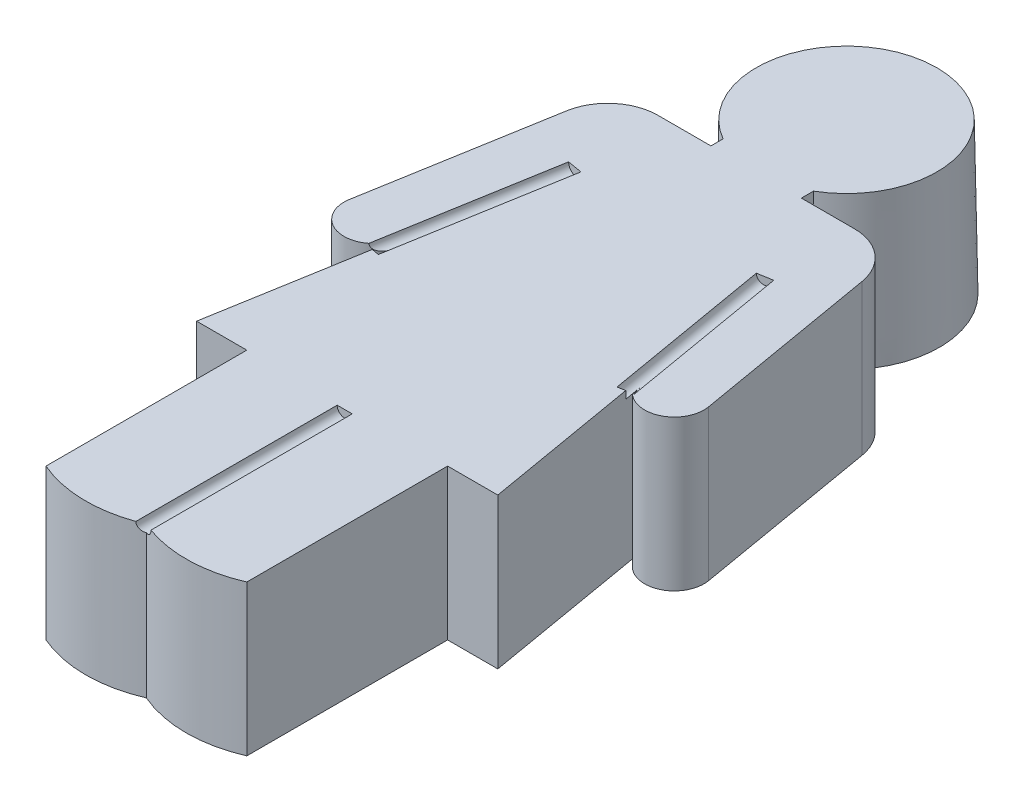
from build123d import *

# Parameters (mm, degrees)
CROQUIS1_R               = 9
SALIENTE_EXTRUIR1_DEPTH  = 15
CORTAR_BARRER3_PROFILE_R = 0.75
CROQUIS150_W             = 9.005753034
CROQUIS150_H             = 1.22445073
SALIENTE_EXTRUIR2_DEPTH  = 15
NGULO_DE_SALIDA1_ANGLE   = 1
REDONDEO1_R              = 5
CORTAR_BARRER6_PROFILE_R = 0.75
CORTAR_BARRER7_PROFILE_R = 0.75


with BuildPart() as part:
    # Croquis1 → Saliente-Extruir1 (new body)
    with BuildSketch(Plane(origin=(0, 0, 0), x_dir=(1, 0, 0), z_dir=(0, 1, 0))):
        with BuildLine():
            Line((-10, -15.730529609), (-10, -35.730529609))
            ThreePointArc((-10, -35.730529609), (-5, -36.769633088), (0, -35.730529609))
            ThreePointArc((0, -35.730529609), (5, -36.769633088), (10, -35.730529609))
            Line((10, -35.730529609), (10, -15.730529609))
            Line((10, -15.730529609), (15, -15.730529609))
            Line((15, -15.730529609), (12.060158198, 1.375372328))
            ThreePointArc((12.060158198, 1.375372328), (15.474883642, -1.037768667), (17.888024636, 2.376956777))
            Line((17.888024636, 2.376956777), (14, 25))
            Line((14, 25), (9, 25))
            Line((9, 25), (3.3e-08, 25))
            Line((3.3e-08, 25), (-9, 25))
            Line((-9, 25), (-14, 25))
            Line((-14, 25), (-17.888024636, 2.376956777))
            ThreePointArc((-17.888024636, 2.376956777), (-15.474883642, -1.037768667), (-12.060158198, 1.375372328))
            Line((-12.060158198, 1.375372328), (-15, -15.730529609))
            Line((-15, -15.730529609), (-10, -15.730529609))
        make_face()
        with Locations(Location((0, 34, 0), (0, 0, 270))):
            Circle(CROQUIS1_R)
    extrude(amount=SALIENTE_EXTRUIR1_DEPTH)

    # Cortar-Barrer3: sweep along a path in Croquis128
    with BuildLine(Plane(origin=(0, 15, 0), x_dir=(1, 0, 0), z_dir=(0, 1, 0))) as cortar_barrer3_path:
        Line((0, -37.988500145), (0, -15.977369951))
    # Cortar-Barrer3 profile (on start of the path) → Cortar-Barrer3 (sweep, cut)
    with BuildSketch(Plane(origin=(0, 15, 37.988500145), x_dir=(-1, 0, 0), z_dir=(0, 0, -1))):
        Circle(CORTAR_BARRER3_PROFILE_R)
    sweep(path=cortar_barrer3_path.line, mode=Mode.SUBTRACT)

    # Croquis150 → Saliente-Extruir2 (add)
    with BuildSketch(Plane(origin=(0, 15, 0), x_dir=(1, 0, 0), z_dir=(0, 1, 0))):
        with Locations((0, 25.595207467)):
            Rectangle(CROQUIS150_W, CROQUIS150_H)
    extrude(amount=-SALIENTE_EXTRUIR2_DEPTH)

    # Ángulo de salida1
    ngulo_de_salida1_faces = [part.faces().sort_by_distance(p)[0] for p in [
        (0, 7.5, -43),
    ]]
    draft(ngulo_de_salida1_faces, Plane.ZX.offset(15), NGULO_DE_SALIDA1_ANGLE)

    # Redondeo1
    redondeo1_edges = [part.edges().sort_by_distance(p)[0] for p in [
        (14, 7.5, -25),
        (-14, 7.5, -25),
    ]]
    fillet(redondeo1_edges, radius=REDONDEO1_R)

    # Cortar-Barrer6: sweep along a path in Croquis153
    with BuildLine(Plane(origin=(0, 15, 0), x_dir=(1, 0, 0), z_dir=(0, 1, 0))) as cortar_barrer6_path:
        Line((-12.434351293, -0.801925236), (-9.476182309, 16.410616107))
    # Cortar-Barrer6 profile (on start of the path) → Cortar-Barrer6 (sweep, cut)
    with BuildSketch(Plane(origin=(-12.434351293, 15, 0.801925236), x_dir=(-0.9855511518924236, 0, -0.1693780593923461), z_dir=(0.1693780593923461, 0, -0.9855511518924236))):
        Circle(CORTAR_BARRER6_PROFILE_R)
    sweep(path=cortar_barrer6_path.line, mode=Mode.SUBTRACT)

    # Cortar-Barrer7: sweep along a path in Croquis222
    with BuildLine(Plane(origin=(0, 15, 0), x_dir=(1, 0, 0), z_dir=(0, 1, 0))) as cortar_barrer7_path:
        Line((9.476182309, 16.410616107), (12.355325185, -0.342100199))
    # Cortar-Barrer7 profile (on start of the path) → Cortar-Barrer7 (sweep, cut)
    with BuildSketch(Plane(origin=(9.476182309, 15, -16.410616107), x_dir=(0.9855511518924236, 0, -0.16937805939234624), z_dir=(0.16937805939234624, 0, 0.9855511518924236))):
        Circle(CORTAR_BARRER7_PROFILE_R)
    sweep(path=cortar_barrer7_path.line, mode=Mode.SUBTRACT)


solid = part.part
